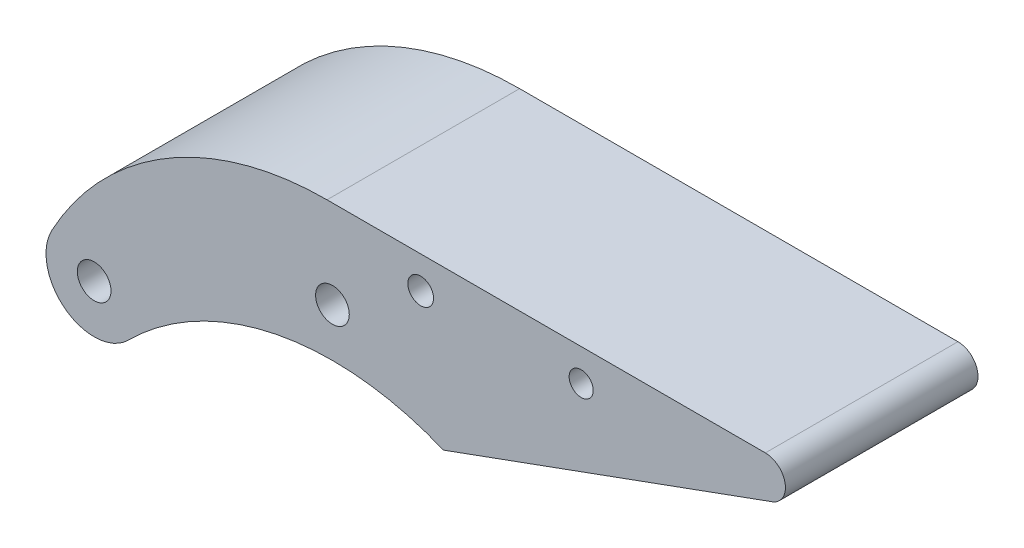
from build123d import *

# Parameters (mm, degrees)
SKETCH_1_R          = 2.1
SKETCH_1_R_2        = 6
EXTRUDE_1_DEPTH     = 24
FILLET_1_R          = 2.5
CUT_EXTRUDE_START   = -24
SKETCH_3_R          = 1.6
SKETCH_3_R_2        = 1.5
SKETCH_3_R_3        = 2.1
CUT_EXTRUDE_2_DEPTH = 24


with BuildPart() as part:
    # 草图1 → 凸台-拉伸1 (new body)
    # profile 1 of 3: a face of its own
    with BuildSketch(Plane.XY):
        with BuildLine():
            Line((68.135486627, 53), (-0.671642545, 53))
            ThreePointArc((-0.671642545, 53), (15.918389352, 49.295479077), (29.356722765, 38.885684233))
            Line((29.356722765, 38.885684233), (68.135486627, 53))
        make_face()
    # profile 2 of 3: a face of its own
    with BuildSketch(Plane.XY):
        with BuildLine():
            ThreePointArc((29.356722765, 38.885684233), (15.918389352, 49.295479077), (-0.671642545, 53))
            ThreePointArc((-0.671642545, 53), (-20.639649059, 47.500428563), (-34.976092597, 32.552754602))
            ThreePointArc((-34.976092597, 32.552754602), (-28.226351446, 35.515083761), (-23.69848481, 29.69848481))
            ThreePointArc((-23.69848481, 29.69848481), (-24.155207625, 27.402384191), (-25.45584416, 25.455844085))
            ThreePointArc((-25.45584416, 25.455844085), (-6.992802508, 35.314313148), (13.833943007, 33.235854448))
            Line((13.833943007, 33.235854448), (29.356722765, 38.885684233))
        make_face()
        with Locations((0, 42)):
            Circle(SKETCH_1_R, mode=Mode.SUBTRACT)
    # profile 3 of 3: a face of its own
    with BuildSketch(Plane.XY):
        with Locations((-29.69848481, 29.69848481)):
            Circle(SKETCH_1_R_2)
        with Locations((-29.69848481, 29.69848481)):
            Circle(SKETCH_1_R, mode=Mode.SUBTRACT)
    extrude(amount=EXTRUDE_1_DEPTH)

    # 圆角1
    fillet_1_edges = [part.edges().sort_by_distance(p)[0] for p in [
        (68.135486627, 53, 12),
    ]]
    fillet(fillet_1_edges, radius=FILLET_1_R)

    # 草图3 → 切除-拉伸2 (cut)
    with BuildSketch(Plane.XY.offset(24).offset(CUT_EXTRUDE_START)):
        with Locations((11, 49)):
            Circle(SKETCH_3_R)
        with Locations((31, 49)):
            Circle(SKETCH_3_R_2)
        with Locations((0, 42)):
            Circle(SKETCH_3_R_3)
    extrude(amount=CUT_EXTRUDE_2_DEPTH, mode=Mode.SUBTRACT)


solid = part.part
